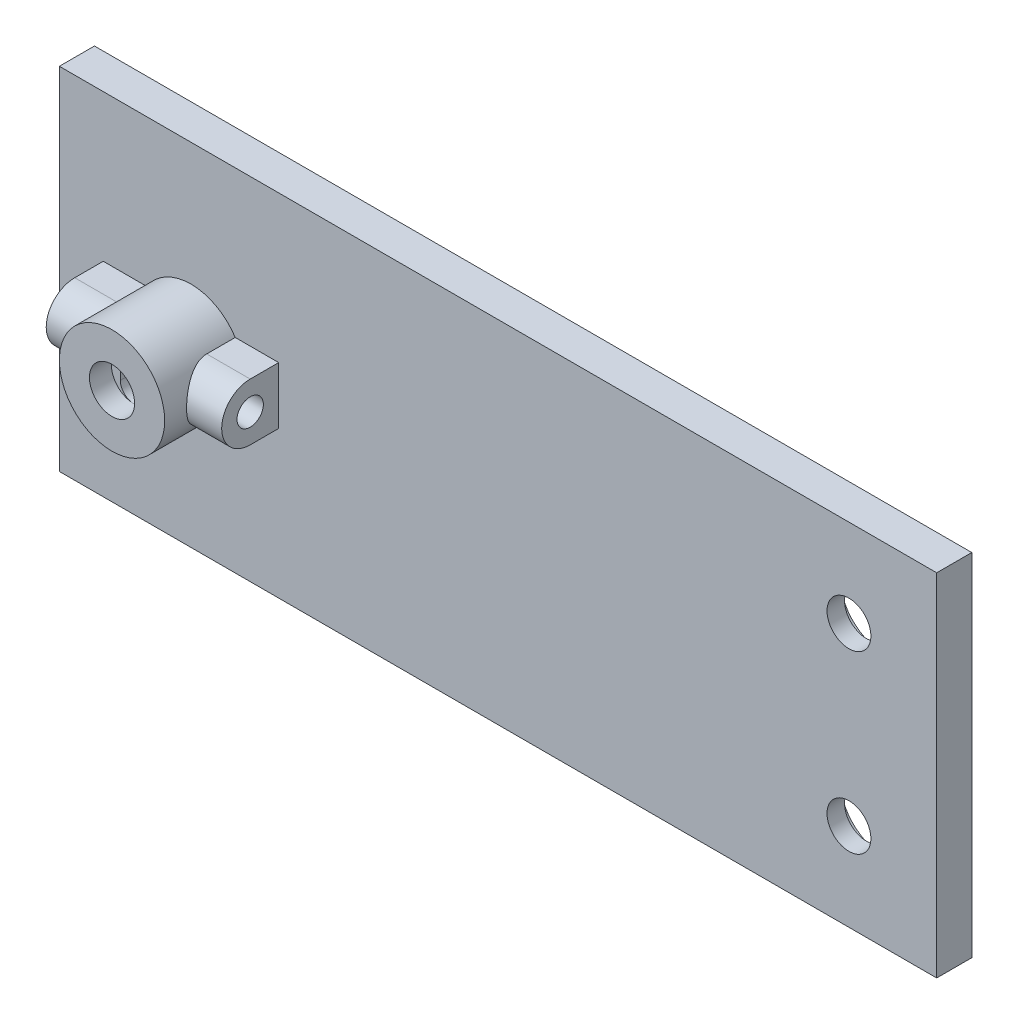
from build123d import *

# Parameters (mm, degrees)
SKETCH1_W                           = 170
SKETCH1_H                           = 40
BOSS_EXTRUDE1_DEPTH                 = 4
SKETCH2_R                           = 6
BOSS_EXTRUDE2_DEPTH                 = 9
SKETCH3_R                           = 2.575
CUT_EXTRUDE1_DEPTH                  = 2.5
CUT_EXTRUDE2_REACH                  = 98.228
CUT_EXTRUDE2_END_RADIUS             = 6
SKETCH4_R                           = 1.25
CUT_EXTRUDE2_DIRECTION_2_REACH      = 98.228
CUT_EXTRUDE2_DIRECTION_2_END_RADIUS = 6
BOSS_EXTRUDE3_START                 = -1
SKETCH6_R                           = 1.5
BOSS_EXTRUDE3_DEPTH                 = 5
SKETCH8_R                           = 5
CUT_EXTRUDE3_DEPTH                  = 2
CUT_EXTRUDE4_REACH                  = 176.989
SKETCH9_R                           = 2.5
CUT_EXTRUDE5_REACH                  = 176.874
SKETCH10_W                          = 70
SKETCH10_H                          = 40


with BuildPart() as part:
    # Sketch1 → Boss-Extrude1 (new body)
    with BuildSketch(Plane.XY):
        with Locations((85, 20)):
            Rectangle(SKETCH1_W, SKETCH1_H)
    extrude(amount=BOSS_EXTRUDE1_DEPTH)

    # Sketch2 → Boss-Extrude2 (add)
    with BuildSketch(Plane.XY.offset(4)):
        with Locations(Location((85, 20, 0), (0, 0, 180))):
            Circle(SKETCH2_R)
        with BuildLine():
            Line((83.45, 18.975), (83.45, 21.025))
            ThreePointArc((83.45, 21.025), (85, 22.575), (86.55, 21.025))
            Line((86.55, 21.025), (86.55, 18.975))
            ThreePointArc((86.55, 18.975), (85, 17.425), (83.45, 18.975))
        make_face(mode=Mode.SUBTRACT)
    extrude(amount=BOSS_EXTRUDE2_DEPTH)

    # Sketch3 → Cut-Extrude1 (cut)
    with BuildSketch(Plane.XY.offset(13)):
        with Locations((85, 20)):
            Circle(SKETCH3_R)
    extrude(amount=-CUT_EXTRUDE1_DEPTH, mode=Mode.SUBTRACT)

    # Cut-Extrude2: up to this cylinder (the profile starts inside it)
    cut_extrude2_end = Plane(origin=(85, 20, 7.25), z_dir=(0, 0, -1)) * Cylinder(CUT_EXTRUDE2_END_RADIUS, 209.456, mode=Mode.PRIVATE)
    # Sketch4 → Cut-Extrude2 (cut, up to the surface)
    with BuildSketch(Plane(origin=(83.45, 0, 0), x_dir=(0, 0, -1), z_dir=(1, 0, 0)), mode=Mode.PRIVATE) as cut_extrude2_sk1:
        with Locations(Location((-7.25, 20, 0), (0, 0, 304.915206247))):
            Circle(SKETCH4_R)
    cut_extrude2_tool1 = extrude(cut_extrude2_sk1.sketch, amount=-CUT_EXTRUDE2_REACH, mode=Mode.PRIVATE) & cut_extrude2_end
    add(cut_extrude2_tool1.solids().sort_by_distance((83.45, 20, 7.25))[0], mode=Mode.SUBTRACT)

    # Cut-Extrude2 direction 2: up to this cylinder (the profile starts inside it)
    cut_extrude2_direction_2_end = Plane(origin=(85, 20, 7.25), z_dir=(0, 0, -1)) * Cylinder(CUT_EXTRUDE2_DIRECTION_2_END_RADIUS, 209.456, mode=Mode.PRIVATE)
    # Sketch4 → Cut-Extrude2 direction 2 (cut, up to the surface)
    with BuildSketch(Plane(origin=(83.45, 0, 0), x_dir=(0, 0, -1), z_dir=(1, 0, 0)), mode=Mode.PRIVATE) as cut_extrude2_direction_2_sk1:
        with Locations(Location((-7.25, 20, 0), (0, 0, 304.915206247))):
            Circle(SKETCH4_R)
    cut_extrude2_direction_2_tool1 = extrude(cut_extrude2_direction_2_sk1.sketch, amount=CUT_EXTRUDE2_DIRECTION_2_REACH, mode=Mode.PRIVATE) & cut_extrude2_direction_2_end
    add(cut_extrude2_direction_2_tool1.solids().sort_by_distance((83.45, 20, 7.25))[0], mode=Mode.SUBTRACT)

    # Sketch6 → Boss-Extrude3 (add)
    with BuildSketch(Plane(origin=(91, 0, 0), x_dir=(0, 0, -1), z_dir=(1, 0, 0)).offset(BOSS_EXTRUDE3_START)):
        with BuildLine():
            Line((-7.25, 23.25), (-4, 23.25))
            Line((-4, 23.25), (-4, 16.75))
            Line((-4, 16.75), (-7.25, 16.75))
            ThreePointArc((-7.25, 16.75), (-10.5, 20), (-7.25, 23.25))
        make_face()
        with Locations((-7.25, 20)):
            Circle(SKETCH6_R, mode=Mode.SUBTRACT)
    boss_extrude3 = extrude(amount=BOSS_EXTRUDE3_DEPTH)

    # Mirror1: Boss-Extrude3 across plane
    add(boss_extrude3.mirror(Plane.ZY.offset(-85)))

    # Sketch8 → Cut-Extrude3 (cut)
    with BuildSketch(Plane(origin=(0, 0, 0), x_dir=(-1, 0, 0), z_dir=(0, 0, -1))):
        with Locations((-160, 30)):
            Circle(SKETCH8_R)
        with Locations((-160, 10)):
            Circle(SKETCH8_R)
    extrude(amount=-CUT_EXTRUDE3_DEPTH, mode=Mode.SUBTRACT)

    # Sketch9 → Cut-Extrude4 (cut, up to next)
    with BuildSketch(Plane(origin=(0, 0, 2), x_dir=(-1, 0, 0), z_dir=(0, 0, -1)), mode=Mode.PRIVATE) as cut_extrude4_sk1:
        with Locations((-160, 10)):
            Circle(SKETCH9_R)
    cut_extrude4_tool1 = extrude(cut_extrude4_sk1.sketch, amount=-CUT_EXTRUDE4_REACH, mode=Mode.PRIVATE) & part.part
    # Sketch9 → Cut-Extrude4 (cut, up to next)
    with BuildSketch(Plane(origin=(0, 0, 2), x_dir=(-1, 0, 0), z_dir=(0, 0, -1)), mode=Mode.PRIVATE) as cut_extrude4_sk2:
        with Locations((-160, 30)):
            Circle(SKETCH9_R)
    cut_extrude4_tool2 = extrude(cut_extrude4_sk2.sketch, amount=-CUT_EXTRUDE4_REACH, mode=Mode.PRIVATE) & part.part
    add(cut_extrude4_tool1.solids().sort_by_distance((160, 10, 2))[0], mode=Mode.SUBTRACT)
    add(cut_extrude4_tool2.solids().sort_by_distance((160, 30, 2))[0], mode=Mode.SUBTRACT)

    # Sketch10 → Cut-Extrude5 (cut, up to next)
    with BuildSketch(Plane.XY.offset(4), mode=Mode.PRIVATE) as cut_extrude5_sk1:
        with Locations((35, 20)):
            Rectangle(SKETCH10_W, SKETCH10_H)
    cut_extrude5_tool1 = extrude(cut_extrude5_sk1.sketch, amount=-CUT_EXTRUDE5_REACH, mode=Mode.PRIVATE) & part.part
    add(cut_extrude5_tool1.solids().sort_by_distance((35, 20, 4))[0], mode=Mode.SUBTRACT)


solid = part.part
